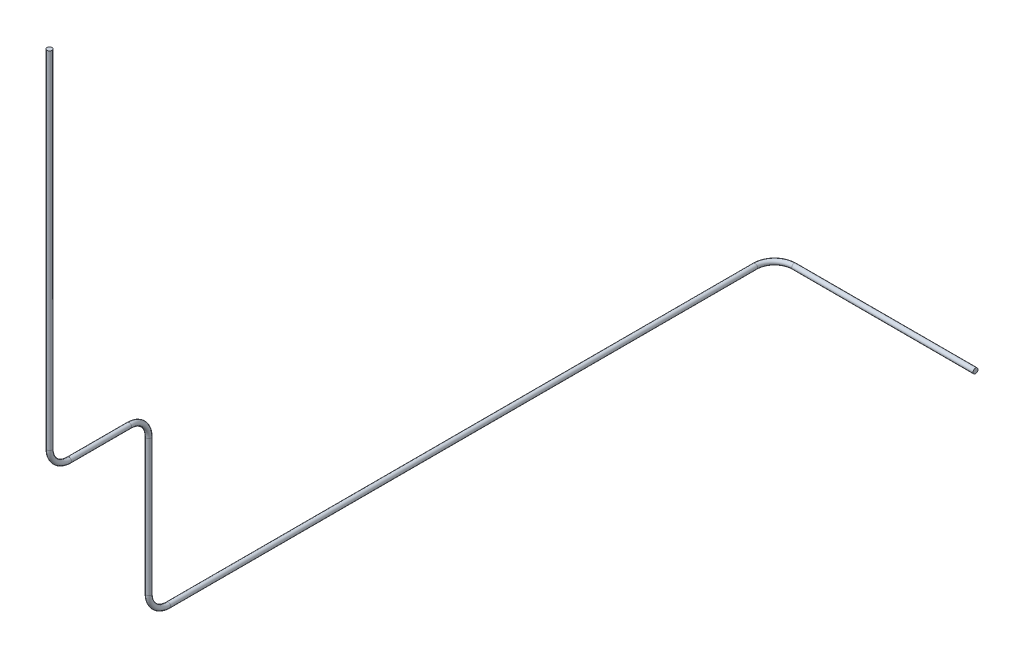
from build123d import *

# Parameters (mm, degrees)
BARRER2_PROFILE_R = 6.35


with BuildPart() as part:
    # Barrer2: sweep along a curve in space
    with BuildLine() as barrer2_path:
        Line((-1396.537201922, -956.74763274, 1867.92), (-1859.814281992, -956.74763274, 1867.92))
        ThreePointArc((-1859.814281992, -956.74763274, 1867.92), (-1895.169621052, -956.74763274, 1882.564660941), (-1909.814281992, -956.74763274, 1917.92))
        Line((-1909.814281992, -956.74763274, 1917.92), (-1909.814281992, -956.74763274, 3416.979261902))
        ThreePointArc((-1909.814281992, -956.74763274, 3416.979261902), (-1909.814281992, -942.102971799, 3452.334600961), (-1909.814281992, -906.74763274, 3466.979261902))
        Line((-1909.814281992, -906.74763274, 3466.979261902), (-1909.814281992, -559.253278673, 3466.979261902))
        ThreePointArc((-1909.814281992, -559.253278673, 3466.979261902), (-1909.814281992, -523.897939613, 3481.623922843), (-1909.814281992, -509.253278673, 3516.979261902))
        Line((-1909.814281992, -509.253278673, 3516.979261902), (-1909.814281992, -509.253278673, 3670.190456999))
        ThreePointArc((-1909.814281992, -509.253278673, 3670.190456999), (-1909.814281992, -494.608617732, 3705.545796059), (-1909.814281992, -459.253278673, 3720.190456999))
        Line((-1909.814281992, -459.253278673, 3720.190456999), (-1909.814281992, 425.180570664, 3720.190456999))
    # Barrer2 profile (on start of the path) → Barrer2 (sweep)
    with BuildSketch(Plane(origin=(-1396.537201922, -956.74763274, 1867.92), x_dir=(0, 0, -1), z_dir=(-1, 0, 0))):
        Circle(BARRER2_PROFILE_R)
    sweep(path=barrer2_path.line)


solid = part.part
